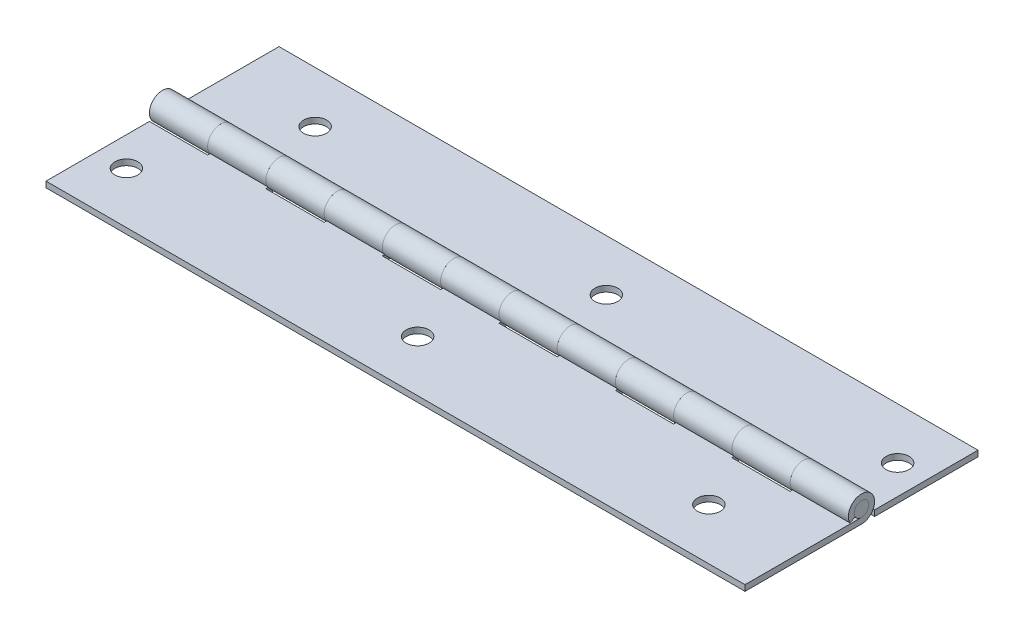
from build123d import *

# Parameters (mm, degrees)
LEFT_LEAF_DEPTH         = 76.2
CUT_EXTRUDE1_DEPTH      = 81.372665168
CUT_EXTRUDE1_DEPTH_BACK = 81.372665168
SKETCH2_W               = 12.7
SKETCH2_H               = 5.715
RIGHT_LEAF_DEPTH        = 76.2
CUT_EXTRUDE2_DEPTH      = 81.372665168
CUT_EXTRUDE2_DEPTH_BACK = 81.372665168
SKETCH9_W               = 12.7
SKETCH9_H               = 5.715
SKETCH10_R              = 1.5875
EXTRUDE1_DEPTH          = 76.2
SKETCH11_R              = 2.5019
CUT_EXTRUDE3_DEPTH      = 81.444751383


with BuildPart() as part:
    # Sketch1 → Left Leaf (new, symmetric)
    with BuildSketch(Plane(origin=(0, 0, 0), x_dir=(0, 0, -1), z_dir=(1, 0, 0))):
        with BuildLine():
            Line((0, -1.5875), (-25.4, -1.5875))
            Line((-25.4, -1.5875), (-25.4, -2.8575))
            Line((-25.4, -2.8575), (0, -2.8575))
            ThreePointArc((0, -2.8575), (1.449117488, 2.462796125), (-2.497904417, -1.387724676))
            Line((-2.497904417, -1.387724676), (-1.387724676, -0.770958153))
            ThreePointArc((-1.387724676, -0.770958153), (0.805065271, 1.36822007), (0, -1.5875))
        make_face()
    extrude(amount=LEFT_LEAF_DEPTH, both=True)

    # Sketch2 → Cut-Extrude1 (cut, two sides: drawn at the far end of the back side and taken through both)
    with BuildSketch(Plane(origin=(0, 0, 0), x_dir=(1, 0, 0), z_dir=(0, 1, 0)).offset(-CUT_EXTRUDE1_DEPTH_BACK)):
        with Locations((-44.45, 0)):
            Rectangle(SKETCH2_W, SKETCH2_H)
        with Locations((-69.85, 0)):
            Rectangle(SKETCH2_W, SKETCH2_H)
        with Locations((57.15, 0)):
            Rectangle(SKETCH2_W, SKETCH2_H)
        with Locations((-19.05, 0)):
            Rectangle(SKETCH2_W, SKETCH2_H)
        with Locations((6.35, 0)):
            Rectangle(SKETCH2_W, SKETCH2_H)
        with Locations((31.75, 0)):
            Rectangle(SKETCH2_W, SKETCH2_H)
    extrude(amount=CUT_EXTRUDE1_DEPTH + CUT_EXTRUDE1_DEPTH_BACK, mode=Mode.SUBTRACT)


with BuildPart() as body_2:
    # Sketch3 → Right Leaf (new, symmetric)
    with BuildSketch(Plane(origin=(0, 0, 0), x_dir=(0, 0, -1), z_dir=(1, 0, 0))):
        with BuildLine():
            Line((25.4, -1.5875), (25.4, -2.8575))
            Line((25.4, -2.8575), (0, -2.8575))
            ThreePointArc((0, -2.8575), (-1.449117488, 2.462796125), (2.497904417, -1.387724676))
            Line((2.497904417, -1.387724676), (1.387724676, -0.770958153))
            ThreePointArc((1.387724676, -0.770958153), (-0.805065271, 1.36822007), (0, -1.5875))
            Line((0, -1.5875), (25.4, -1.5875))
        make_face()
    extrude(amount=RIGHT_LEAF_DEPTH, both=True)

    # Sketch9 → Cut-Extrude2 (cut, two sides: drawn at the far end of the back side and taken through both)
    with BuildSketch(Plane(origin=(0, 0, 0), x_dir=(1, 0, 0), z_dir=(0, 1, 0)).offset(-CUT_EXTRUDE2_DEPTH_BACK)):
        with Locations((-57.15, 0)):
            Rectangle(SKETCH9_W, SKETCH9_H)
        with Locations((-31.75, 0)):
            Rectangle(SKETCH9_W, SKETCH9_H)
        with Locations((-6.35, 0)):
            Rectangle(SKETCH9_W, SKETCH9_H)
        with Locations((19.05, 0)):
            Rectangle(SKETCH9_W, SKETCH9_H)
        with Locations((44.45, 0)):
            Rectangle(SKETCH9_W, SKETCH9_H)
        with Locations((69.85, 0)):
            Rectangle(SKETCH9_W, SKETCH9_H)
    extrude(amount=CUT_EXTRUDE2_DEPTH + CUT_EXTRUDE2_DEPTH_BACK, mode=Mode.SUBTRACT)


with BuildPart() as body_3:
    # Sketch10 → Extrude1 (new, symmetric)
    with BuildSketch(Plane(origin=(0, 0, 0), x_dir=(0, 0, -1), z_dir=(1, 0, 0))):
        with Locations(Location((0, 0, 0), (0, 0, 180))):
            Circle(SKETCH10_R)
    extrude(amount=EXTRUDE1_DEPTH, both=True)


with BuildPart() as cut_extrude3_tool:
    # Sketch11 → Cut-Extrude3 (new, through all)
    with BuildSketch(Plane(origin=(0, -1.5875, 0), x_dir=(-1, 0, 0), z_dir=(0, 1, 0))):
        with Locations(Location((-69.85, -14.224, 0), (0, 0, 90))):
            Circle(SKETCH11_R)
        with Locations(Location((-57.15, 14.224, 0), (0, 0, 90))):
            Circle(SKETCH11_R)
        with Locations(Location((-6.35, -14.224, 0), (0, 0, 90))):
            Circle(SKETCH11_R)
        with Locations(Location((6.35, 14.224, 0), (0, 0, 90))):
            Circle(SKETCH11_R)
        with Locations(Location((69.85, 14.224, 0), (0, 0, 90))):
            Circle(SKETCH11_R)
        with Locations(Location((57.15, -14.224, 0), (0, 0, 90))):
            Circle(SKETCH11_R)
    extrude(amount=-CUT_EXTRUDE3_DEPTH)


with BuildPart() as part_1:
    add(part.part)

    # Cut-Extrude3: cut by cut_extrude3_tool
    add(cut_extrude3_tool.part, mode=Mode.SUBTRACT)


with BuildPart() as body_2_1:
    add(body_2.part)

    # Cut-Extrude3: cut by cut_extrude3_tool
    add(cut_extrude3_tool.part, mode=Mode.SUBTRACT)


solid = Compound([body_3.part, part_1.part, body_2_1.part])
